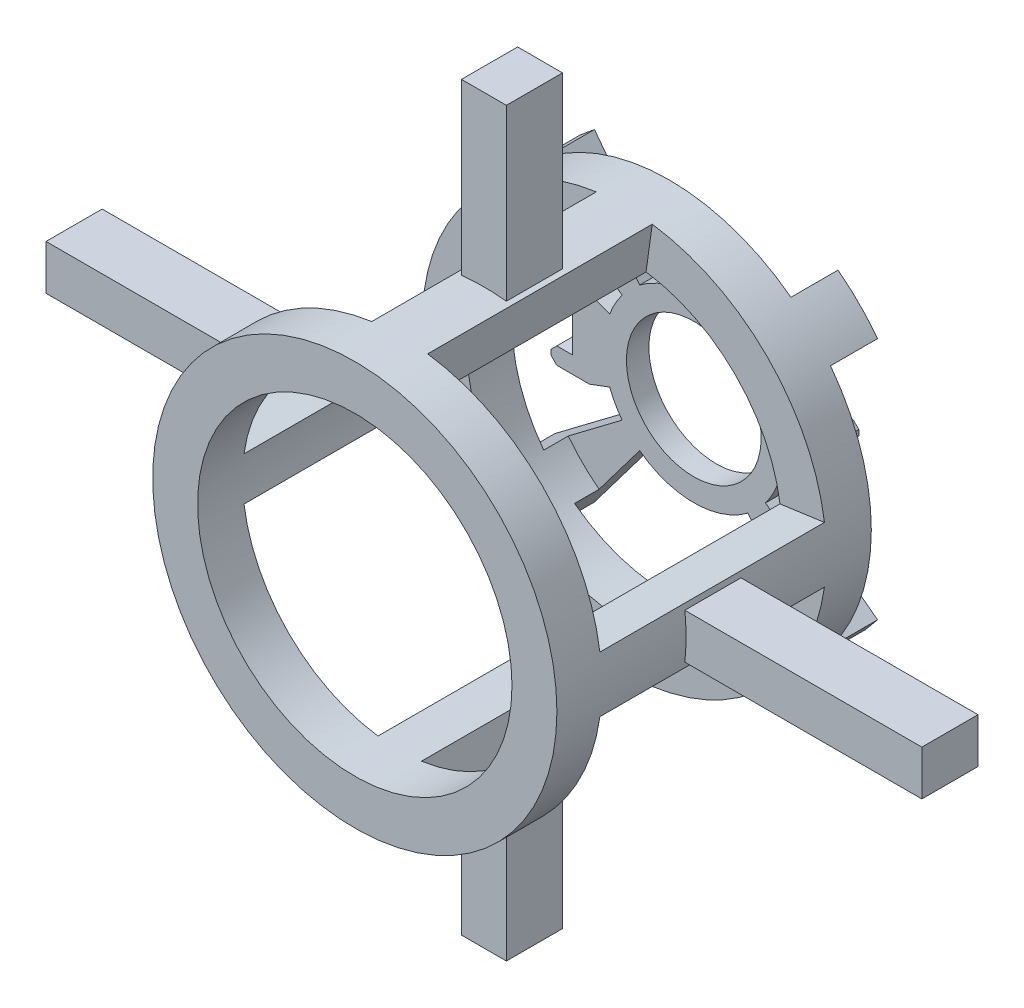
from build123d import *
from build123d.topology import SkipClean

# Parameters (mm, degrees)
BOSS_EXTRUDE1_DEPTH        = 10
BOSS_EXTRUDE1_DEPTH_BACK   = 10
BOSS_EXTRUDE1_2_DEPTH      = 10
BOSS_EXTRUDE1_2_DEPTH_BACK = 10
BOSS_EXTRUDE1_3_DEPTH      = 10
BOSS_EXTRUDE1_3_DEPTH_BACK = 10
BOSS_EXTRUDE1_4_DEPTH      = 10
BOSS_EXTRUDE1_4_DEPTH_BACK = 10
SKETCH2_R                  = 18
SKETCH2_R_2                = 14
BOSS_EXTRUDE2_DEPTH        = 4
BOSS_EXTRUDE3_START        = 4
SKETCH3_R                  = 18
SKETCH3_R_2                = 14
BOSS_EXTRUDE3_DEPTH        = 4
BOSS_EXTRUDE4_START        = 2.19
BOSS_EXTRUDE4_DEPTH        = 2.19
BOSS_EXTRUDE5_START        = 2
SKETCH5_R                  = 6
BOSS_EXTRUDE5_DEPTH        = 2
BOSS_EXTRUDE6_DEPTH        = 2.5
BOSS_EXTRUDE6_DEPTH_BACK   = 2.5


with BuildPart() as part:
    # Sketch1 → Boss-Extrude1 (new, two sides: drawn at the far end of the back side and taken through both)
    with BuildSketch(Plane.XY.offset(-BOSS_EXTRUDE1_DEPTH_BACK)):
        with BuildLine():
            Line((-2.491970197, -17.826667791), (-1.938199042, -13.86518606))
            ThreePointArc((-1.938199042, -13.86518606), (0, -14), (1.938199042, -13.86518606))
            Line((1.938199042, -13.86518606), (2.491970197, -17.826667791))
            ThreePointArc((2.491970197, -17.826667791), (0, -18), (-2.491970197, -17.826667791))
        make_face()
    extrude(amount=BOSS_EXTRUDE1_DEPTH + BOSS_EXTRUDE1_DEPTH_BACK)



with BuildPart() as body_2:
    # Sketch1 → Boss-Extrude1 2 (new, two sides: drawn at the far end of the back side and taken through both)
    with BuildSketch(Plane.XY.offset(-BOSS_EXTRUDE1_2_DEPTH_BACK)):
        with BuildLine():
            Line((-17.826667791, -2.491970197), (-13.86518606, -1.938199042))
            ThreePointArc((-13.86518606, -1.938199042), (-14, 0), (-13.86518606, 1.938199042))
            Line((-13.86518606, 1.938199042), (-17.826667791, 2.491970197))
            ThreePointArc((-17.826667791, 2.491970197), (-18, 0), (-17.826667791, -2.491970197))
        make_face()
    extrude(amount=BOSS_EXTRUDE1_2_DEPTH + BOSS_EXTRUDE1_2_DEPTH_BACK)


with BuildPart() as body_3:
    # Sketch1 → Boss-Extrude1 3 (new, two sides: drawn at the far end of the back side and taken through both)
    with BuildSketch(Plane.XY.offset(-BOSS_EXTRUDE1_3_DEPTH_BACK)):
        with BuildLine():
            Line((-2.491970197, 17.826667791), (-1.938199042, 13.86518606))
            ThreePointArc((-1.938199042, 13.86518606), (0, 14), (1.938199042, 13.86518606))
            Line((1.938199042, 13.86518606), (2.491970197, 17.826667791))
            ThreePointArc((2.491970197, 17.826667791), (0, 18), (-2.491970197, 17.826667791))
        make_face()
    extrude(amount=BOSS_EXTRUDE1_3_DEPTH + BOSS_EXTRUDE1_3_DEPTH_BACK)


with BuildPart() as body_4:
    # Sketch1 → Boss-Extrude1 4 (new, two sides: drawn at the far end of the back side and taken through both)
    with BuildSketch(Plane.XY.offset(-BOSS_EXTRUDE1_4_DEPTH_BACK)):
        with BuildLine():
            Line((17.826667791, -2.491970197), (13.86518606, -1.938199042))
            ThreePointArc((13.86518606, -1.938199042), (14, 0), (13.86518606, 1.938199042))
            Line((13.86518606, 1.938199042), (17.826667791, 2.491970197))
            ThreePointArc((17.826667791, 2.491970197), (18, 0), (17.826667791, -2.491970197))
        make_face()
    extrude(amount=BOSS_EXTRUDE1_4_DEPTH + BOSS_EXTRUDE1_4_DEPTH_BACK)


with BuildPart() as part_1:
    with SkipClean():  # the faces are left unmerged after this step: merging them gives an invalid solid
        add(part.part)

        add(body_2.part)  # Boss-Extrude2 merges body 2

        add(body_3.part)  # Boss-Extrude2 merges body 3

        add(body_4.part)  # Boss-Extrude2 merges body 4
        # Sketch2 → Boss-Extrude2 (add)
        with BuildSketch(Plane.XY.offset(10)):
            Circle(SKETCH2_R)
            Circle(SKETCH2_R_2, mode=Mode.SUBTRACT)
        extrude(amount=BOSS_EXTRUDE2_DEPTH)

    # Sketch3 → Boss-Extrude3 (add)
    with SkipClean():  # the faces are left unmerged after this step: merging them gives an invalid solid
        with BuildSketch(Plane(origin=(0, 0, -10), x_dir=(-1, 0, 0), z_dir=(0, 0, -1)).offset(BOSS_EXTRUDE3_START)):
            Circle(SKETCH3_R)
            Circle(SKETCH3_R_2, mode=Mode.SUBTRACT)
        extrude(amount=-BOSS_EXTRUDE3_DEPTH)

    # Sketch4 → Boss-Extrude4 (add)
    with SkipClean():  # the faces are left unmerged after this step: merging them gives an invalid solid
        with BuildSketch(Plane(origin=(0, 0, -14), x_dir=(-1, 0, 0), z_dir=(0, 0, -1)).offset(BOSS_EXTRUDE4_START)):
            with BuildLine():
                Line((10.843268656, -14.367446706), (8.433653399, -11.174680771))
                ThreePointArc((8.433653399, -11.174680771), (9.899494937, -9.899494937), (11.174680771, -8.433653399))
                Line((11.174680771, -8.433653399), (14.367446706, -10.843268656))
                ThreePointArc((14.367446706, -10.843268656), (12.727922061, -12.727922061), (10.843268656, -14.367446706))
            make_face()
            with BuildLine():
                Line((-10.843268656, -14.367446706), (-8.433653399, -11.174680771))
                ThreePointArc((-8.433653399, -11.174680771), (-9.899494937, -9.899494937), (-11.174680771, -8.433653399))
                Line((-11.174680771, -8.433653399), (-14.367446706, -10.843268656))
                ThreePointArc((-14.367446706, -10.843268656), (-12.727922061, -12.727922061), (-10.843268656, -14.367446706))
            make_face()
            with BuildLine():
                Line((14.367446706, 10.843268656), (11.174680771, 8.433653399))
                ThreePointArc((11.174680771, 8.433653399), (9.899494937, 9.899494937), (8.433653399, 11.174680771))
                Line((8.433653399, 11.174680771), (10.843268656, 14.367446706))
                ThreePointArc((10.843268656, 14.367446706), (12.727922061, 12.727922061), (14.367446706, 10.843268656))
            make_face()
            with BuildLine():
                Line((-8.433653399, 11.174680771), (-10.843268656, 14.367446706))
                ThreePointArc((-10.843268656, 14.367446706), (-12.727922061, 12.727922061), (-14.367446706, 10.843268656))
                Line((-14.367446706, 10.843268656), (-11.174680771, 8.433653399))
                ThreePointArc((-11.174680771, 8.433653399), (-9.899494937, 9.899494937), (-8.433653399, 11.174680771))
            make_face()
        extrude(amount=-BOSS_EXTRUDE4_DEPTH)

    # Sketch5 → Boss-Extrude5 (add)
    with SkipClean():  # the faces are left unmerged after this step: merging them gives an invalid solid
        with BuildSketch(Plane(origin=(0, 0, -16.19), x_dir=(-1, 0, 0), z_dir=(0, 0, -1)).offset(BOSS_EXTRUDE5_START)):
            with BuildLine():
                Line((-10.843268656, 14.367446706), (-4.819230514, 6.385531869))
                ThreePointArc((-4.819230514, 6.385531869), (0, 8), (4.819230514, 6.385531869))
                Line((4.819230514, 6.385531869), (10.843268656, 14.367446706))
                ThreePointArc((10.843268656, 14.367446706), (12.727922061, 12.727922061), (14.367446706, 10.843268656))
                Line((14.367446706, 10.843268656), (6.385531869, 4.819230514))
                ThreePointArc((6.385531869, 4.819230514), (7.008239781, 3.858053288), (7.487319643, 2.817808468))
                Line((7.487319643, 2.817808468), (9.3, 3.5))
                Line((9.3, 3.5), (12.2, 3.5))
                Line((12.2, 3.5), (12.7, 3))
                Line((12.7, 3), (12.7, 2.5))
                Line((12.7, 2.5), (12.2, 2))
                Line((12.2, 2), (10.8, 2))
                Line((10.8, 2), (10.8, -2))
                Line((10.8, -2), (12.2, -2))
                Line((12.2, -2), (12.7, -2.5))
                Line((12.7, -2.5), (12.7, -3))
                Line((12.7, -3), (12.2, -3.5))
                Line((12.2, -3.5), (9.3, -3.5))
                Line((9.3, -3.5), (7.487319643, -2.817808468))
                ThreePointArc((7.487319643, -2.817808468), (7.008239781, -3.858053288), (6.385531869, -4.819230514))
                Line((6.385531869, -4.819230514), (14.367446706, -10.843268656))
                ThreePointArc((14.367446706, -10.843268656), (12.727922061, -12.727922061), (10.843268656, -14.367446706))
                Line((10.843268656, -14.367446706), (4.819230514, -6.385531869))
                ThreePointArc((4.819230514, -6.385531869), (0, -8), (-4.819230514, -6.385531869))
                Line((-4.819230514, -6.385531869), (-10.843268656, -14.367446706))
                ThreePointArc((-10.843268656, -14.367446706), (-12.727922061, -12.727922061), (-14.367446706, -10.843268656))
                Line((-14.367446706, -10.843268656), (-6.385531869, -4.819230514))
                ThreePointArc((-6.385531869, -4.819230514), (-7.008239781, -3.858053288), (-7.487319643, -2.817808468))
                Line((-7.487319643, -2.817808468), (-9.3, -3.5))
                Line((-9.3, -3.5), (-12.2, -3.5))
                Line((-12.2, -3.5), (-12.7, -3))
                Line((-12.7, -3), (-12.7, -2.5))
                Line((-12.7, -2.5), (-12.2, -2))
                Line((-12.2, -2), (-10.8, -2))
                Line((-10.8, -2), (-10.8, 2))
                Line((-10.8, 2), (-12.2, 2))
                Line((-12.2, 2), (-12.7, 2.5))
                Line((-12.7, 2.5), (-12.7, 3))
                Line((-12.7, 3), (-12.2, 3.5))
                Line((-12.2, 3.5), (-9.3, 3.5))
                Line((-9.3, 3.5), (-7.487319643, 2.817808468))
                ThreePointArc((-7.487319643, 2.817808468), (-7.008239781, 3.858053288), (-6.385531869, 4.819230514))
                Line((-6.385531869, 4.819230514), (-14.367446706, 10.843268656))
                ThreePointArc((-14.367446706, 10.843268656), (-12.727922061, 12.727922061), (-10.843268656, 14.367446706))
            make_face()
            Circle(SKETCH5_R, mode=Mode.SUBTRACT)
        extrude(amount=-BOSS_EXTRUDE5_DEPTH)

    # Sketch6 → Boss-Extrude6 (add, two sides: drawn at the far end of the back side and taken through both)
    with SkipClean():  # the faces are left unmerged after this step: merging them gives an invalid solid
        with BuildSketch(Plane.XY.offset(-BOSS_EXTRUDE6_DEPTH_BACK)):
            with BuildLine():
                Line((-39, 2), (-15.874507866, 2))
                ThreePointArc((-15.874507866, 2), (-16, 0), (-15.874507866, -2))
                Line((-15.874507866, -2), (-39, -2))
                Line((-39, -2), (-39, 2))
            make_face()
            with BuildLine():
                Line((39, 2), (39, -2))
                Line((39, -2), (15.874507866, -2))
                ThreePointArc((15.874507866, -2), (16, 0), (15.874507866, 2))
                Line((15.874507866, 2), (39, 2))
            make_face()
            with BuildLine():
                Line((-2, 33), (2, 33))
                Line((2, 33), (2, 15.874507866))
                ThreePointArc((2, 15.874507866), (0, 16), (-2, 15.874507866))
                Line((-2, 15.874507866), (-2, 33))
            make_face()
            with BuildLine():
                Line((-2, -33), (2, -33))
                Line((2, -33), (2, -15.874507866))
                ThreePointArc((2, -15.874507866), (0, -16), (-2, -15.874507866))
                Line((-2, -15.874507866), (-2, -33))
            make_face()
        extrude(amount=BOSS_EXTRUDE6_DEPTH + BOSS_EXTRUDE6_DEPTH_BACK)


solid = part_1.part
